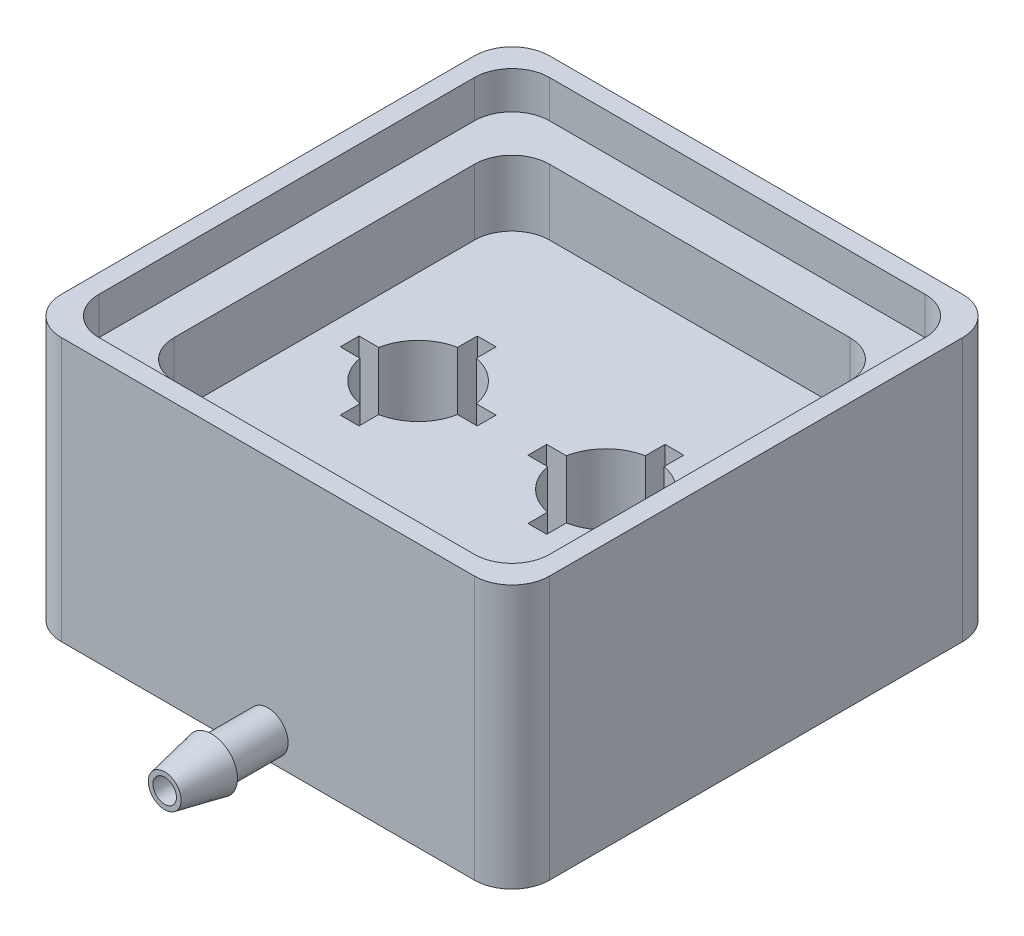
from build123d import *

# Parameters (mm, degrees)
SKETCH1_R                      = 2.65
BOSS_EXTRUDE1_DEPTH            = 8.53
CUT_EXTRUDE1_START             = -7.785
CUT_EXTRUDE1_DEPTH             = 7.785
CUT_EXTRUDE3_REACH             = 26.166
SKETCH10_R                     = 0.625
CUT_EXTRUDE3_DIRECTION_2_REACH = 26.166
CUT_EXTRUDE2_REACH             = 32.295
SKETCH5_R                      = 0.625
BOSS_EXTRUDE2_DEPTH            = 3.5
BOSS_EXTRUDE3_DEPTH            = 2


with BuildPart() as part:
    # Sketch1 → Boss-Extrude1 (new body)
    with BuildSketch(Plane(origin=(0, 0, 0), x_dir=(1, 0, 0), z_dir=(0, 1, 0))):
        with BuildLine():
            Line((-11, -13), (11, -13))
            ThreePointArc((11, -13), (12.414213562, -12.414213562), (13, -11))
            Line((13, -11), (13, 11))
            ThreePointArc((13, 11), (12.414213562, 12.414213562), (11, 13))
            Line((11, 13), (-11, 13))
            ThreePointArc((-11, 13), (-12.414213562, 12.414213562), (-13, 11))
            Line((-13, 11), (-13, -11))
            ThreePointArc((-13, -11), (-12.414213562, -12.414213562), (-11, -13))
        make_face()
        with Locations(Location((5, 0, 0), (0, 0, 270))):
            Circle(SKETCH1_R, mode=Mode.SUBTRACT)
        with Locations(Location((-5, 0, 0), (0, 0, 270))):
            Circle(SKETCH1_R, mode=Mode.SUBTRACT)
    extrude(amount=BOSS_EXTRUDE1_DEPTH)

    # Sketch2 → Cut-Extrude1 (cut)
    with BuildSketch(Plane(origin=(0, 8.53, 0), x_dir=(1, 0, 0), z_dir=(0, 1, 0)).offset(CUT_EXTRUDE1_START)):
        with BuildLine():
            Line((4.5, 3.65), (4.5, 2.602402736))
            ThreePointArc((4.5, 2.602402736), (5, 2.65), (5.5, 2.602402736))
            Line((5.5, 2.602402736), (5.5, 3.65))
            Line((5.5, 3.65), (4.5, 3.65))
        make_face()
        with BuildLine():
            ThreePointArc((7.65, 0), (7.638073848, -0.251130195), (7.602402736, -0.5))
            Line((7.602402736, -0.5), (8.65, -0.5))
            Line((8.65, -0.5), (8.65, 0.5))
            Line((8.65, 0.5), (7.602402736, 0.5))
            ThreePointArc((7.602402736, 0.5), (7.638073848, 0.251130195), (7.65, 0))
        make_face()
        with BuildLine():
            Line((4.5, -2.602402736), (4.5, -3.65))
            Line((4.5, -3.65), (5.5, -3.65))
            Line((5.5, -3.65), (5.5, -2.602402736))
            ThreePointArc((5.5, -2.602402736), (5, -2.65), (4.5, -2.602402736))
        make_face()
        with BuildLine():
            Line((1.35, -0.5), (2.397597264, -0.5))
            ThreePointArc((2.397597264, -0.5), (2.35, 0), (2.397597264, 0.5))
            Line((2.397597264, 0.5), (1.35, 0.5))
            Line((1.35, 0.5), (1.35, -0.5))
        make_face()
        with BuildLine():
            ThreePointArc((-2.35, 0), (-2.361926152, -0.251130195), (-2.397597264, -0.5))
            Line((-2.397597264, -0.5), (-1.35, -0.5))
            Line((-1.35, -0.5), (-1.35, 0.5))
            Line((-1.35, 0.5), (-2.397597264, 0.5))
            ThreePointArc((-2.397597264, 0.5), (-2.361926152, 0.251130195), (-2.35, 0))
        make_face()
        with BuildLine():
            Line((-5.5, 3.65), (-5.5, 2.602402736))
            ThreePointArc((-5.5, 2.602402736), (-5, 2.65), (-4.5, 2.602402736))
            Line((-4.5, 2.602402736), (-4.5, 3.65))
            Line((-4.5, 3.65), (-5.5, 3.65))
        make_face()
        with BuildLine():
            Line((-8.65, 0.5), (-8.65, -0.5))
            Line((-8.65, -0.5), (-7.602402736, -0.5))
            ThreePointArc((-7.602402736, -0.5), (-7.65, 0), (-7.602402736, 0.5))
            Line((-7.602402736, 0.5), (-8.65, 0.5))
        make_face()
        with BuildLine():
            ThreePointArc((-4.5, -2.602402736), (-5, -2.65), (-5.5, -2.602402736))
            Line((-5.5, -2.602402736), (-5.5, -3.65))
            Line((-5.5, -3.65), (-4.5, -3.65))
            Line((-4.5, -3.65), (-4.5, -2.602402736))
        make_face()
    extrude(amount=CUT_EXTRUDE1_DEPTH, mode=Mode.SUBTRACT)

    # Sketch3 → Revolve1 (revolve)
    with BuildSketch(Plane(origin=(0, 0, 0), x_dir=(0, 0, -1), z_dir=(1, 0, 0)), mode=Mode.PRIVATE) as revolve1_sk:
        Polygon((-13, 0.3), (-16, 0.3), (-16, 0), (-18.5, 0.5), (-18.5, 0.75), (-13, 0.75), align=None)
    revolve(revolve1_sk.sketch.rotate(Axis((0, 1.375, 13), (0, 0, 1)), 180), axis=Axis((0, 1.375, 13), (0, 0, 1)))

    # Sketch10 → Cut-Extrude3 (cut, up to next)
    with BuildSketch(Plane(origin=(0, 0, 0), x_dir=(0, 0, -1), z_dir=(1, 0, 0)), mode=Mode.PRIVATE) as cut_extrude3_sk1:
        with Locations(Location((0, 1.375, 0), (0, 0, 143.130102406))):
            Circle(SKETCH10_R)
    cut_extrude3_tool1 = extrude(cut_extrude3_sk1.sketch, amount=-CUT_EXTRUDE3_REACH, mode=Mode.PRIVATE) & part.part
    add(cut_extrude3_tool1.solids().sort_by_distance((0, 1.375, 0))[0], mode=Mode.SUBTRACT)

    # Sketch10 → Cut-Extrude3 direction 2 (cut, up to next)
    with BuildSketch(Plane(origin=(0, 0, 0), x_dir=(0, 0, -1), z_dir=(1, 0, 0)), mode=Mode.PRIVATE) as cut_extrude3_direction_2_sk1:
        with Locations(Location((0, 1.375, 0), (0, 0, 143.130102406))):
            Circle(SKETCH10_R)
    cut_extrude3_direction_2_tool1 = extrude(cut_extrude3_direction_2_sk1.sketch, amount=CUT_EXTRUDE3_DIRECTION_2_REACH, mode=Mode.PRIVATE) & part.part
    add(cut_extrude3_direction_2_tool1.solids().sort_by_distance((0, 1.375, 0))[0], mode=Mode.SUBTRACT)

    # Sketch5 → Cut-Extrude2 (cut, up to next)
    with BuildSketch(Plane.XY.offset(13), mode=Mode.PRIVATE) as cut_extrude2_sk1:
        with Locations(Location((0, 1.375, 0), (0, 0, 90))):
            Circle(SKETCH5_R)
    cut_extrude2_tool1 = extrude(cut_extrude2_sk1.sketch, amount=-CUT_EXTRUDE2_REACH, mode=Mode.PRIVATE) & part.part
    add(cut_extrude2_tool1.solids().sort_by_distance((0, 1.375, 13))[0], mode=Mode.SUBTRACT)

    # Sketch6 → Boss-Extrude2 (add)
    with BuildSketch(Plane(origin=(0, 8.53, 0), x_dir=(1, 0, 0), z_dir=(0, 1, 0))):
        with BuildLine():
            Line((-11, -13), (11, -13))
            ThreePointArc((11, -13), (12.414213562, -12.414213562), (13, -11))
            Line((13, -11), (13, 11))
            ThreePointArc((13, 11), (12.414213562, 12.414213562), (11, 13))
            Line((11, 13), (-11, 13))
            ThreePointArc((-11, 13), (-12.414213562, 12.414213562), (-13, 11))
            Line((-13, 11), (-13, -11))
            ThreePointArc((-13, -11), (-12.414213562, -12.414213562), (-11, -13))
        make_face()
        with BuildLine():
            Line((-8, -10), (8, -10))
            ThreePointArc((8, -10), (9.414213562, -9.414213562), (10, -8))
            Line((10, -8), (10, 8))
            ThreePointArc((10, 8), (9.414213562, 9.414213562), (8, 10))
            Line((8, 10), (-8, 10))
            ThreePointArc((-8, 10), (-9.414213562, 9.414213562), (-10, 8))
            Line((-10, 8), (-10, -8))
            ThreePointArc((-10, -8), (-9.414213562, -9.414213562), (-8, -10))
        make_face(mode=Mode.SUBTRACT)
    extrude(amount=BOSS_EXTRUDE2_DEPTH)

    # Sketch8 → Boss-Extrude3 (add)
    with BuildSketch(Plane(origin=(0, 12.03, 0), x_dir=(1, 0, 0), z_dir=(0, 1, 0))):
        with BuildLine():
            Line((-11, -13), (11, -13))
            ThreePointArc((11, -13), (12.414213562, -12.414213562), (13, -11))
            Line((13, -11), (13, 11))
            ThreePointArc((13, 11), (12.414213562, 12.414213562), (11, 13))
            Line((11, 13), (-11, 13))
            ThreePointArc((-11, 13), (-12.414213562, 12.414213562), (-13, 11))
            Line((-13, 11), (-13, -11))
            ThreePointArc((-13, -11), (-12.414213562, -12.414213562), (-11, -13))
        make_face()
        with BuildLine():
            Line((-10, -12), (10, -12))
            ThreePointArc((10, -12), (11.414213562, -11.414213562), (12, -10))
            Line((12, -10), (12, 10))
            ThreePointArc((12, 10), (11.414213562, 11.414213562), (10, 12))
            Line((10, 12), (-10, 12))
            ThreePointArc((-10, 12), (-11.414213562, 11.414213562), (-12, 10))
            Line((-12, 10), (-12, -10))
            ThreePointArc((-12, -10), (-11.414213562, -11.414213562), (-10, -12))
        make_face(mode=Mode.SUBTRACT)
    extrude(amount=BOSS_EXTRUDE3_DEPTH)


solid = part.part
